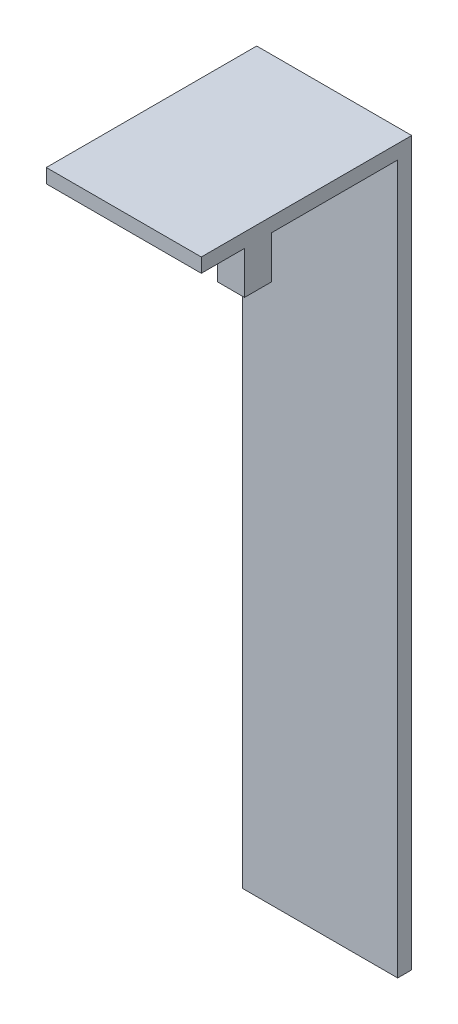
from build123d import *

# Parameters (mm, degrees)
BOSS_EXTRUDE1_DEPTH = 1
SKETCH1_3_W         = 1.9
SKETCH1_3_H         = 1.9
BOSS_EXTRUDE2_DEPTH = 3
SKETCH1_4_W         = 10.9395
SKETCH1_4_H         = 0.99
BOSS_EXTRUDE3_DEPTH = 50


with BuildPart() as part:
    # Sketch1 → Boss-Extrude1 (new body)
    with BuildSketch(Plane(origin=(0, 0, 0), x_dir=(1, 0, 0), z_dir=(0, 1, 0))):
        Polygon((-5.46975, -4.95), (0, -4.95), (5.46975, -4.95), (5.46975, 9.9), (-5.46975, 9.9), align=None)
    extrude(amount=BOSS_EXTRUDE1_DEPTH)

    # Sketch1<3> → Boss-Extrude2 (add)
    with BuildSketch(Plane(origin=(0, 0, 0), x_dir=(1, 0, 0), z_dir=(0, 1, 0))):
        with Locations((-4.51975, -0.95)):
            Rectangle(SKETCH1_3_W, SKETCH1_3_H)
        with Locations((4.51975, -0.95)):
            Rectangle(SKETCH1_3_W, SKETCH1_3_H)
    extrude(amount=-BOSS_EXTRUDE2_DEPTH)

    # Sketch1<4> → Boss-Extrude3 (add)
    with BuildSketch(Plane(origin=(0, 0, 0), x_dir=(1, 0, 0), z_dir=(0, 1, 0))):
        with Locations((0, 9.405)):
            Rectangle(SKETCH1_4_W, SKETCH1_4_H)
    extrude(amount=-BOSS_EXTRUDE3_DEPTH)


solid = part.part
